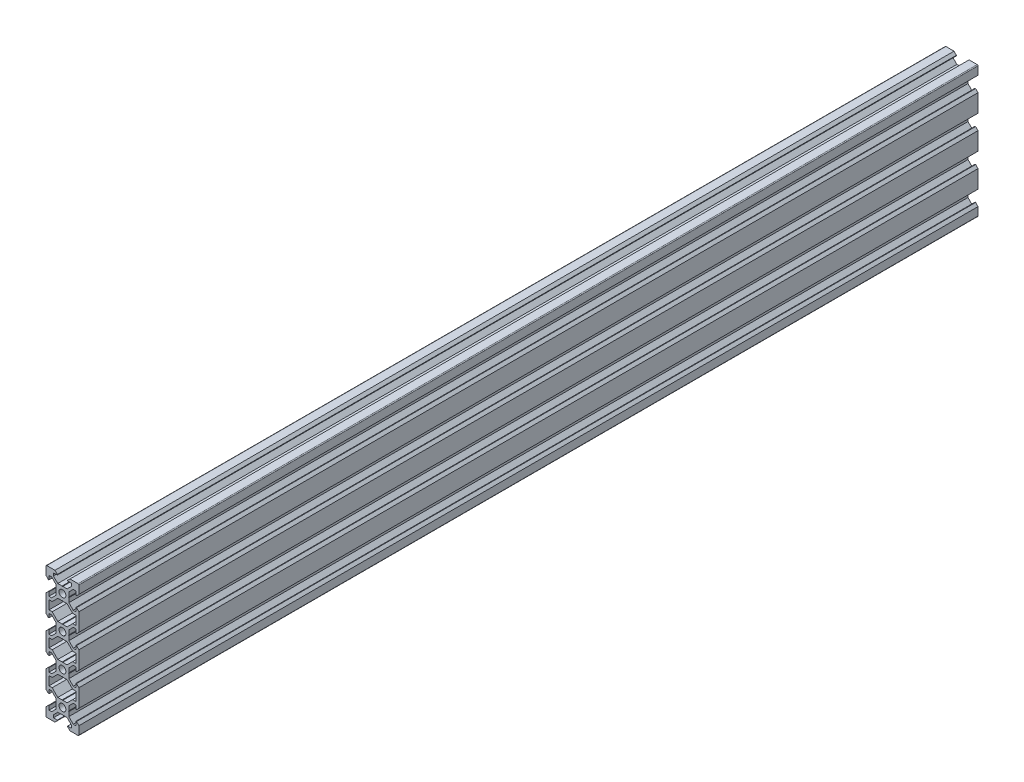
from build123d import *

# Parameters (mm, degrees)
BOSS_EXTRU_1_DEPTH = 546.8


with BuildPart() as part:
    # Esquisse1 → Boss.-Extru.1 (new body)
    with BuildSketch(Plane.XY):
        with BuildLine():
            Line((-9.5, 10), (-4.58, 10))
            Line((-4.58, 10), (-3.125, 8.545))
            Line((-3.125, 8.545), (-3.125, 8.2))
            Line((-3.125, 8.2), (-5.5, 8.2))
            Line((-5.5, 8.2), (-5.5, 6.560660172))
            Line((-5.5, 6.560660172), (-2.839339828, 3.9))
            Line((-2.839339828, 3.9), (-0.21, 3.9))
            Line((-0.21, 3.9), (0, 3.69))
            Line((0, 3.69), (0, 2.1))
            ThreePointArc((0, 2.1), (-2.1, 0), (0, -2.1))
            Line((0, -2.1), (0, -3.69))
            Line((0, -3.69), (-0.21, -3.9))
            Line((-0.21, -3.9), (-2.839339828, -3.9))
            Line((-2.839339828, -3.9), (-6.239339828, -7.3))
            Line((-6.239339828, -7.3), (-8.2, -7.3))
            Line((-8.2, -7.3), (-8.2, -12.7))
            Line((-8.2, -12.7), (-6.239339828, -12.7))
            Line((-6.239339828, -12.7), (-2.839339828, -16.1))
            Line((-2.839339828, -16.1), (-0.21, -16.1))
            Line((-0.21, -16.1), (0, -16.31))
            Line((0, -16.31), (0, -17.9))
            ThreePointArc((0, -17.9), (-2.1, -20), (0, -22.1))
            Line((0, -22.1), (0, -23.69))
            Line((0, -23.69), (-0.21, -23.9))
            Line((-0.21, -23.9), (-2.839339828, -23.9))
            Line((-2.839339828, -23.9), (-6.239339828, -27.3))
            Line((-6.239339828, -27.3), (-8.2, -27.3))
            Line((-8.2, -27.3), (-8.2, -32.7))
            Line((-8.2, -32.7), (-6.239339828, -32.7))
            Line((-6.239339828, -32.7), (-2.839339828, -36.1))
            Line((-2.839339828, -36.1), (-0.21, -36.1))
            Line((-0.21, -36.1), (0, -36.31))
            Line((0, -36.31), (0, -37.9))
            ThreePointArc((0, -37.9), (-2.1, -40), (0, -42.1))
            Line((0, -42.1), (0, -43.69))
            Line((0, -43.69), (-0.21, -43.9))
            Line((-0.21, -43.9), (-2.839339828, -43.9))
            Line((-2.839339828, -43.9), (-6.239339828, -47.3))
            Line((-6.239339828, -47.3), (-8.2, -47.3))
            Line((-8.2, -47.3), (-8.2, -52.7))
            Line((-8.2, -52.7), (-6.239339828, -52.7))
            Line((-6.239339828, -52.7), (-2.839339828, -56.1))
            Line((-2.839339828, -56.1), (-0.21, -56.1))
            Line((-0.21, -56.1), (0, -56.31))
            Line((0, -56.31), (0, -57.9))
            ThreePointArc((0, -57.9), (-2.1, -60), (0, -62.1))
            Line((0, -62.1), (0, -63.69))
            Line((0, -63.69), (-0.21, -63.9))
            Line((-0.21, -63.9), (-2.839339828, -63.9))
            Line((-2.839339828, -63.9), (-5.5, -66.560660172))
            Line((-5.5, -66.560660172), (-5.5, -68.2))
            Line((-5.5, -68.2), (-3.125, -68.2))
            Line((-3.125, -68.2), (-3.125, -68.545))
            Line((-3.125, -68.545), (-4.58, -70))
            Line((-4.58, -70), (-9.5, -70))
            ThreePointArc((-9.5, -70), (-9.853553391, -69.853553391), (-10, -69.5))
            Line((-10, -69.5), (-10, -64.58))
            Line((-10, -64.58), (-8.545, -63.125))
            Line((-8.545, -63.125), (-8.2, -63.125))
            Line((-8.2, -63.125), (-8.2, -65.5))
            Line((-8.2, -65.5), (-6.560660172, -65.5))
            Line((-6.560660172, -65.5), (-3.9, -62.839339828))
            Line((-3.9, -62.839339828), (-3.9, -60.21))
            Line((-3.9, -60.21), (-3.69, -60))
            Line((-3.69, -60), (-3.9, -59.79))
            Line((-3.9, -59.79), (-3.9, -57.160660172))
            Line((-3.9, -57.160660172), (-6.560660172, -54.5))
            Line((-6.560660172, -54.5), (-8.2, -54.5))
            Line((-8.2, -54.5), (-8.2, -56.875))
            Line((-8.2, -56.875), (-8.545, -56.875))
            Line((-8.545, -56.875), (-10, -55.42))
            Line((-10, -55.42), (-10, -44.58))
            Line((-10, -44.58), (-8.545, -43.125))
            Line((-8.545, -43.125), (-8.2, -43.125))
            Line((-8.2, -43.125), (-8.2, -45.5))
            Line((-8.2, -45.5), (-6.560660172, -45.5))
            Line((-6.560660172, -45.5), (-3.9, -42.839339828))
            Line((-3.9, -42.839339828), (-3.9, -40.21))
            Line((-3.9, -40.21), (-3.69, -40))
            Line((-3.69, -40), (-3.9, -39.79))
            Line((-3.9, -39.79), (-3.9, -37.160660172))
            Line((-3.9, -37.160660172), (-6.560660172, -34.5))
            Line((-6.560660172, -34.5), (-8.2, -34.5))
            Line((-8.2, -34.5), (-8.2, -36.875))
            Line((-8.2, -36.875), (-8.545, -36.875))
            Line((-8.545, -36.875), (-10, -35.42))
            Line((-10, -35.42), (-10, -24.58))
            Line((-10, -24.58), (-8.545, -23.125))
            Line((-8.545, -23.125), (-8.2, -23.125))
            Line((-8.2, -23.125), (-8.2, -25.5))
            Line((-8.2, -25.5), (-6.560660172, -25.5))
            Line((-6.560660172, -25.5), (-3.9, -22.839339828))
            Line((-3.9, -22.839339828), (-3.9, -20.21))
            Line((-3.9, -20.21), (-3.69, -20))
            Line((-3.69, -20), (-3.9, -19.79))
            Line((-3.9, -19.79), (-3.9, -17.160660172))
            Line((-3.9, -17.160660172), (-6.560660172, -14.5))
            Line((-6.560660172, -14.5), (-8.2, -14.5))
            Line((-8.2, -14.5), (-8.2, -16.875))
            Line((-8.2, -16.875), (-8.545, -16.875))
            Line((-8.545, -16.875), (-10, -15.42))
            Line((-10, -15.42), (-10, -4.58))
            Line((-10, -4.58), (-8.545, -3.125))
            Line((-8.545, -3.125), (-8.2, -3.125))
            Line((-8.2, -3.125), (-8.2, -5.5))
            Line((-8.2, -5.5), (-6.560660172, -5.5))
            Line((-6.560660172, -5.5), (-3.9, -2.839339828))
            Line((-3.9, -2.839339828), (-3.9, -0.21))
            Line((-3.9, -0.21), (-3.69, 0))
            Line((-3.69, 0), (-3.9, 0.21))
            Line((-3.9, 0.21), (-3.9, 2.839339828))
            Line((-3.9, 2.839339828), (-6.560660172, 5.5))
            Line((-6.560660172, 5.5), (-8.2, 5.5))
            Line((-8.2, 5.5), (-8.2, 3.125))
            Line((-8.2, 3.125), (-8.545, 3.125))
            Line((-8.545, 3.125), (-10, 4.58))
            Line((-10, 4.58), (-10, 9.5))
            ThreePointArc((-10, 9.5), (-9.853553391, 9.853553391), (-9.5, 10))
        make_face()
    boss_extru_1 = extrude(amount=BOSS_EXTRU_1_DEPTH)

    # Symétrie1: Boss.-Extru.1 across plane
    add(boss_extru_1.mirror(Plane(origin=(0, 3.69, 546.8), x_dir=(0, 0, 1), z_dir=(-1, 0, 0))))


solid = part.part
